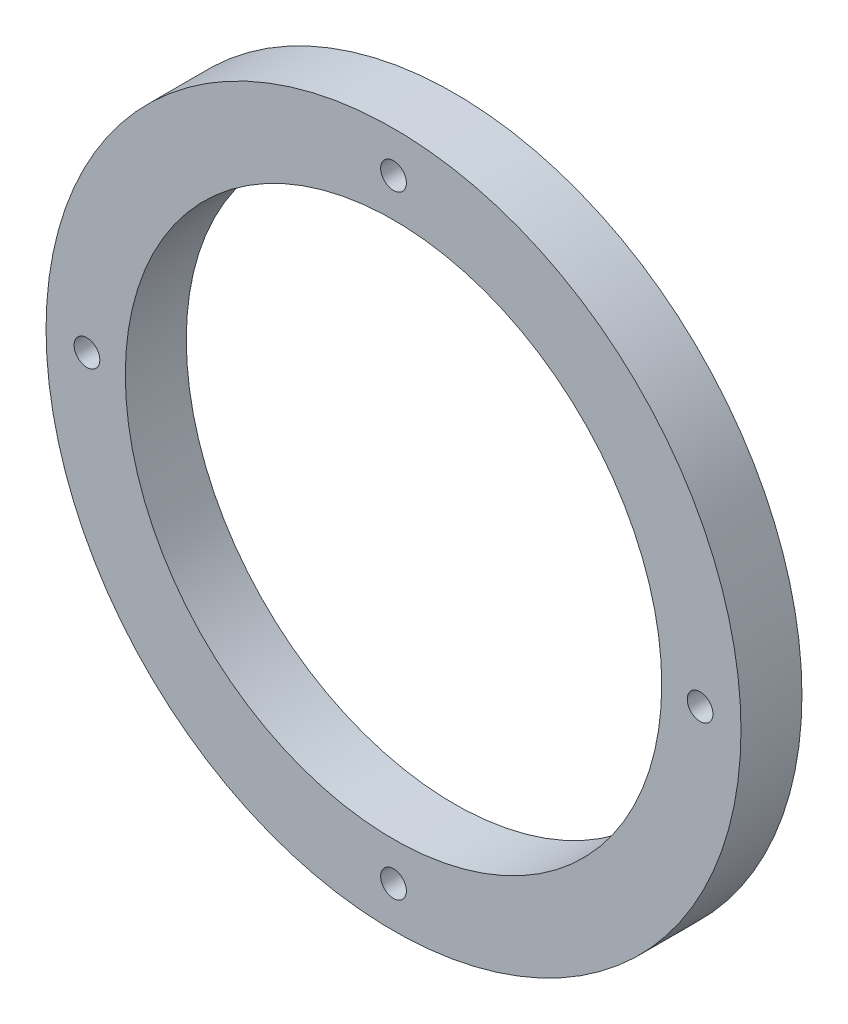
from build123d import *

# Parameters (mm, degrees)
SKETCH1_R           = 57
BOSS_EXTRUDE1_DEPTH = 10
SKETCH2_R           = 44
CUT_EXTRUDE1_DEPTH  = 10
SKETCH3_R           = 2.110545821
CUT_EXTRUDE2_DEPTH  = 10


with BuildPart() as part:
    # Sketch1 → Boss-Extrude1 (new body)
    with BuildSketch(Plane.XY):
        Circle(SKETCH1_R)
    extrude(amount=BOSS_EXTRUDE1_DEPTH)

    # Sketch2 → Cut-Extrude1 (cut)
    with BuildSketch(Plane.XY.offset(10)):
        Circle(SKETCH2_R)
    extrude(amount=-CUT_EXTRUDE1_DEPTH, mode=Mode.SUBTRACT)

    # Sketch3 → Cut-Extrude2 (cut)
    with BuildSketch(Plane.XY.offset(10)):
        with Locations((-50.290061508, 0)):
            Circle(SKETCH3_R)
        with Locations((0, 50.290061508)):
            Circle(SKETCH3_R)
        with Locations((50.290061508, 0)):
            Circle(SKETCH3_R)
        with Locations((0, -50.290061508)):
            Circle(SKETCH3_R)
    extrude(amount=-CUT_EXTRUDE2_DEPTH, mode=Mode.SUBTRACT)


solid = part.part
